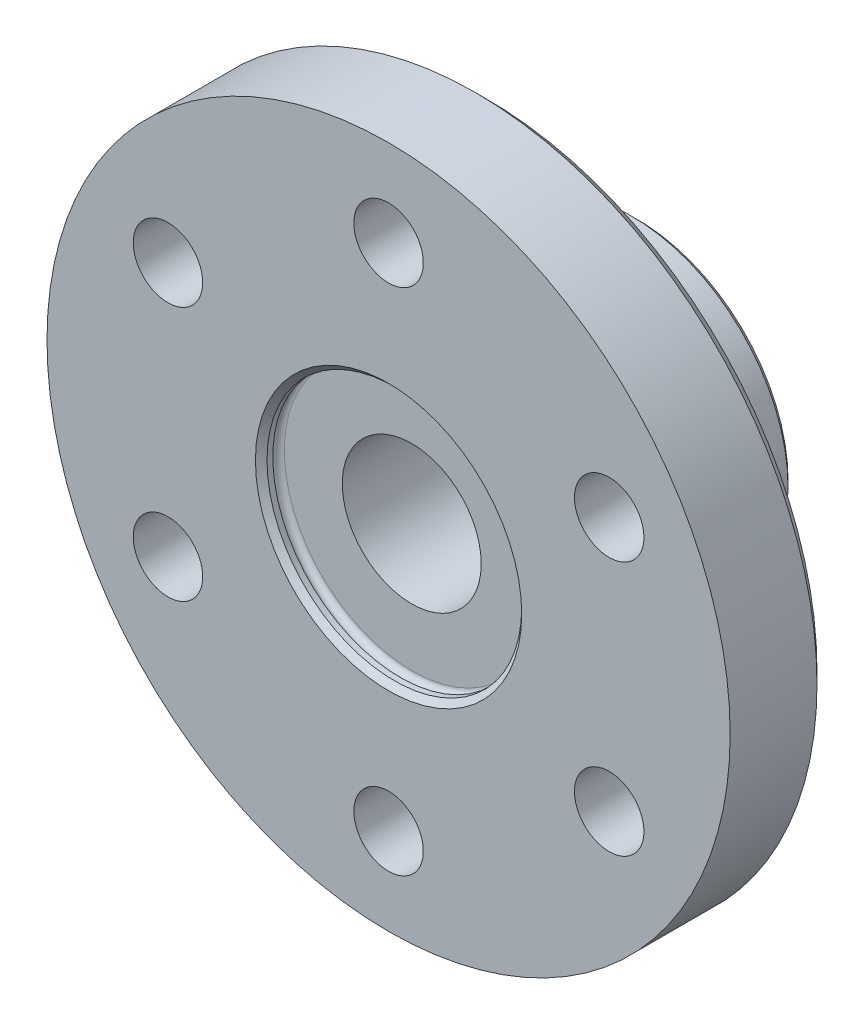
from build123d import *

# Parameters (mm, degrees)
CUT_EXTRUDE1_REACH = 89.396
SKETCH2_R          = 6
CIRPATTERN1_COUNT  = 6
FILLET1_R          = 2
CHAMFER1_SIZE      = 1
CHAMFER2_SIZE      = 2


with BuildPart() as part:
    # Sketch1 → Revolve1 (revolve)
    with BuildSketch(Plane(origin=(0, 0, 0), x_dir=(0, 0, -1), z_dir=(1, 0, 0)), mode=Mode.PRIVATE) as revolve1_sk:
        with BuildLine():
            Line((1.376389422, 12), (1.376389422, 22))
            ThreePointArc((1.376389422, 22), (0.376389422, 23), (-0.623610578, 22))
            Line((-0.623610578, 22), (-2.623610578, 22))
            Line((-2.623610578, 22), (-2.623610578, 59))
            Line((-2.623610578, 59), (14.376389422, 59))
            Line((14.376389422, 59), (14.376389422, 27))
            Line((14.376389422, 27), (40.376389422, 27))
            Line((40.376389422, 27), (40.376389422, 12))
            Line((40.376389422, 12), (1.376389422, 12))
        make_face()
    revolve(revolve1_sk.sketch.rotate(Axis((0, 0, 9.001223373), (0, 0, -1)), 90), axis=Axis((0, 0, 9.001223373), (0, 0, -1)))

    # Sketch2 → Cut-Extrude1 (cut, up to next)
    with BuildSketch(Plane(origin=(0, 0, -14.376389422), x_dir=(-1, 0, 0), z_dir=(0, 0, -1)), mode=Mode.PRIVATE) as cut_extrude1_sk1:
        with Locations((0, 44)):
            Circle(SKETCH2_R)
    cut_extrude1_tool1 = extrude(cut_extrude1_sk1.sketch, amount=-CUT_EXTRUDE1_REACH, mode=Mode.PRIVATE) & part.part
    cut_extrude1 = cut_extrude1_tool1.solids().sort_by_distance((0, 44, -14.376389))[0]
    add(cut_extrude1, mode=Mode.SUBTRACT)

    # CirPattern1: Cut-Extrude1 ×6 about axis
    cirpattern1_axis = Axis((0, 0, 0), (0, 0, 1))
    for i in range(1, CIRPATTERN1_COUNT):
        add(cut_extrude1.rotate(cirpattern1_axis, i * 360 / CIRPATTERN1_COUNT), mode=Mode.SUBTRACT)

    # Fillet1
    fillet1_edges = [part.edges().sort_by_distance(p)[0] for p in [
        (-27, 0, -14.376389422),
    ]]
    fillet(fillet1_edges, radius=FILLET1_R)

    # Chamfer1
    chamfer1_edges = [part.edges().sort_by_distance(p)[0] for p in [
        (-12, 0, -40.376389422),
        (-22, 0, 2.623610578),
        (-27, 0, -40.376389422),
    ]]
    chamfer(chamfer1_edges, length=CHAMFER1_SIZE)

    # Chamfer2
    chamfer2_edges = [part.edges().sort_by_distance(p)[0] for p in [
        (-59, 0, -14.376389422),
    ]]
    chamfer(chamfer2_edges, length=CHAMFER2_SIZE)


solid = part.part
